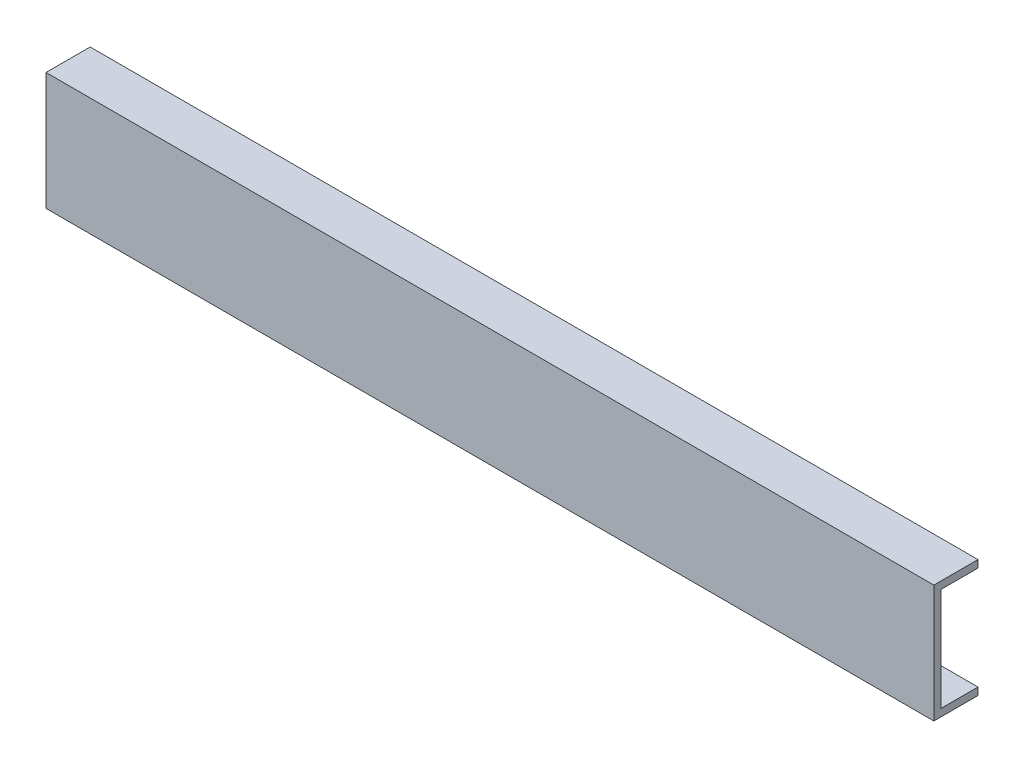
from build123d import *

# Parameters (mm, degrees)
BOSS_EXTRUDE1_DEPTH = 603.25


with BuildPart() as part:
    # Sketch1 → Boss-Extrude1 (new body)
    with BuildSketch(Plane(origin=(0, 0, 0), x_dir=(0, 0, -1), z_dir=(1, 0, 0))):
        Polygon((0, 65.837588936), (30, 65.837588936), (30, 60.837588936), (5, 60.837588936), (5, -9.162411064), (30, -9.162411064), (30, -14.162411064), (0, -14.162411064), align=None)
    extrude(amount=BOSS_EXTRUDE1_DEPTH)


solid = part.part
